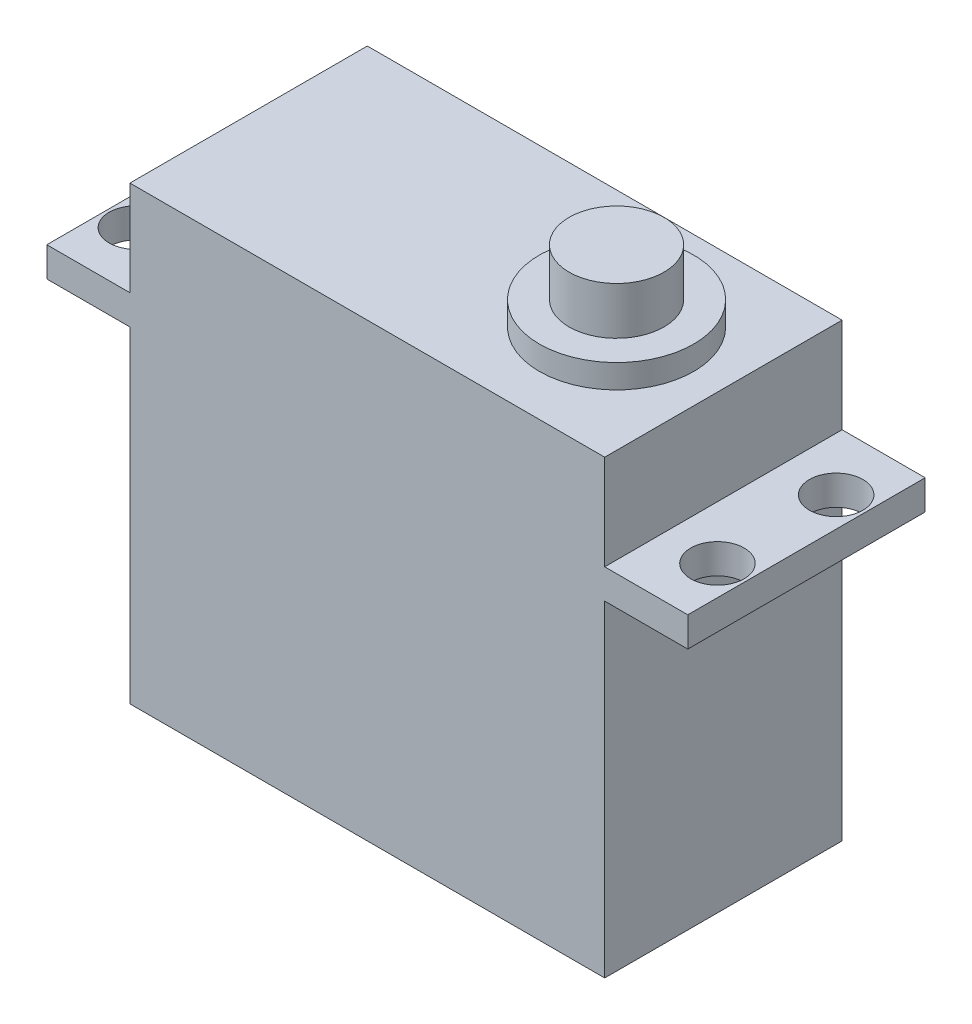
from build123d import *

# Parameters (mm, degrees)
SKETCH1_W           = 40
SKETCH1_H           = 20
BOSS_EXTRUDE1_DEPTH = 38
SKETCH1_3_R         = 4
BOSS_EXTRUDE2_DEPTH = 6
SKETCH2_R           = 6.5
BOSS_EXTRUDE3_DEPTH = 2
SKETCH3_W           = 7
SKETCH3_H           = 20
SKETCH3_R           = 2.25
BOSS_EXTRUDE4_DEPTH = 2.5


with BuildPart() as part:
    # Sketch1 → Boss-Extrude1 (new body)
    with BuildSketch(Plane(origin=(0, 0, 0), x_dir=(1, 0, 0), z_dir=(0, 1, 0))):
        with Locations((-11, 0)):
            Rectangle(SKETCH1_W, SKETCH1_H)
    extrude(amount=-BOSS_EXTRUDE1_DEPTH)

    # Sketch1<3> → Boss-Extrude2 (add)
    with BuildSketch(Plane(origin=(0, 0, 0), x_dir=(1, 0, 0), z_dir=(0, 1, 0))):
        Circle(SKETCH1_3_R)
    extrude(amount=BOSS_EXTRUDE2_DEPTH)

    # Sketch2 → Boss-Extrude3 (add)
    with BuildSketch(Plane(origin=(0, 0, 0), x_dir=(1, 0, 0), z_dir=(0, 1, 0))):
        Circle(SKETCH2_R)
    extrude(amount=BOSS_EXTRUDE3_DEPTH)


with BuildPart() as body_2:
    # Sketch3 → Boss-Extrude4 (new body)
    with BuildSketch(Plane(origin=(0, -8, 0), x_dir=(-1, 0, 0), z_dir=(0, -1, 0))):
        with Locations((-12.5, 0)):
            Rectangle(SKETCH3_W, SKETCH3_H)
        with Locations((-13.5, 5)):
            Circle(SKETCH3_R, mode=Mode.SUBTRACT)
        with Locations((-13.5, -5)):
            Circle(SKETCH3_R, mode=Mode.SUBTRACT)
    extrude(amount=BOSS_EXTRUDE4_DEPTH)


with BuildPart() as body_3:
    # Mirror1: mirrored copy
    add(body_2.part.mirror(Plane(origin=(-11, 0, 0), x_dir=(0, 0, 1), z_dir=(1, 0, 0))))

    # Combine1: union part, body 2
    add(part.part)
    add(body_2.part)


solid = body_3.part
